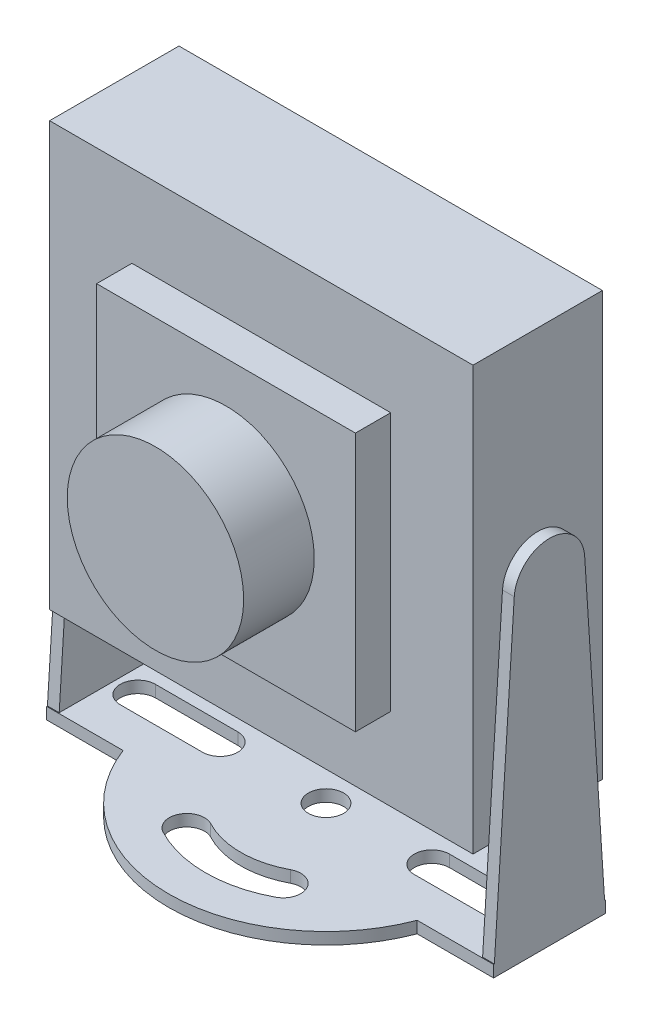
from build123d import *

# Parameters (mm, degrees)
SKETCH_1_W          = 36
SKETCH_1_H          = 36
EXTRUDE_1_DEPTH     = 11
SKETCH_2_W          = 22
SKETCH_2_H          = 22
EXTRUDE_2_DEPTH     = 3
SKETCH_3_R          = 7.5
EXTRUDE_3_DEPTH     = 6
EXTRUDE_4_DEPTH     = 1
EXTRUDE_5_DEPTH     = 1
SKETCH_6_R          = 1.5
CUT_EXTRUDE_1_DEPTH = 1


with BuildPart() as part:
    # 草图1 → 凸台-拉伸1 (new body)
    with BuildSketch(Plane.XY):
        Rectangle(SKETCH_1_W, SKETCH_1_H)
    extrude(amount=EXTRUDE_1_DEPTH)

    # 草图2 → 凸台-拉伸2 (add)
    with BuildSketch(Plane.XY.offset(11)):
        Rectangle(SKETCH_2_W, SKETCH_2_H)
    extrude(amount=EXTRUDE_2_DEPTH)

    # 草图3 → 凸台-拉伸3 (add)
    with BuildSketch(Plane.XY.offset(14)):
        Circle(SKETCH_3_R)
    extrude(amount=EXTRUDE_3_DEPTH)

    # 草图4 → 凸台-拉伸4 (add)
    with BuildSketch(Plane(origin=(18, 0, 0), x_dir=(0, 0, -1), z_dir=(1, 0, 0))):
        with BuildLine():
            Line((-8.493762994, 0.193347193), (-10.25, -27))
            Line((-10.25, -27), (-0.75, -27))
            Line((-0.75, -27), (-2.506237006, 0.193347193))
            ThreePointArc((-2.506237006, 0.193347193), (-5.5, 3), (-8.493762994, 0.193347193))
        make_face()
    extrude_4 = extrude(amount=EXTRUDE_4_DEPTH)

    # 镜向1: 凸台-拉伸4 across plane
    add(extrude_4.mirror(Plane(origin=(0, 0, 0), x_dir=(0, 0, 1), z_dir=(1, 0, 0))))

    # 草图5 → 凸台-拉伸5 (add)
    with BuildSketch(Plane.XZ.offset(27)):
        with BuildLine():
            Line((-19, 10.25), (-12.5, 10.25))
            ThreePointArc((-12.5, 10.25), (0, 18.87207912), (12.5, 10.25))
            Line((12.5, 10.25), (19, 10.25))
            Line((19, 10.25), (19, 0.75))
            Line((19, 0.75), (12.5, 0.75))
            ThreePointArc((12.5, 0.75), (0, -7.87207912), (-12.5, 0.75))
            Line((-12.5, 0.75), (-19, 0.75))
            Line((-19, 0.75), (-19, 10.25))
        make_face()
    extrude(amount=-EXTRUDE_5_DEPTH)

    # 草图6 → 切除-拉伸1 (cut)
    with BuildSketch(Plane.XZ.offset(27)):
        with Locations((0, 5.5)):
            Circle(SKETCH_6_R)
        with BuildLine():
            Line((-16, 7), (-9, 7))
            ThreePointArc((-9, 7), (-7.5, 5.5), (-9, 4))
            Line((-9, 4), (-16, 4))
            ThreePointArc((-16, 4), (-17.5, 5.5), (-16, 7))
        make_face()
        with BuildLine():
            Line((9, 7), (16, 7))
            ThreePointArc((16, 7), (17.5, 5.5), (16, 4))
            Line((16, 4), (9, 4))
            ThreePointArc((9, 4), (7.5, 5.5), (9, 7))
        make_face()
        with BuildLine():
            ThreePointArc((-4.79529689, 14.55926341), (0, 15.750128087), (4.79529689, 14.55926341))
            ThreePointArc((4.79529689, 14.55926341), (5.419284193, 12.531792117), (3.3918129, 11.907804814))
            ThreePointArc((3.3918129, 11.907804814), (0, 12.750128087), (-3.3918129, 11.907804814))
            ThreePointArc((-3.3918129, 11.907804814), (-5.419284193, 12.531792117), (-4.79529689, 14.55926341))
        make_face()
        with BuildLine():
            ThreePointArc((-4.79529689, -3.55926341), (-5.419284193, -1.531792117), (-3.3918129, -0.907804814))
            ThreePointArc((-3.3918129, -0.907804814), (0, -1.750128087), (3.3918129, -0.907804814))
            ThreePointArc((3.3918129, -0.907804814), (5.419284193, -1.531792117), (4.79529689, -3.55926341))
            ThreePointArc((4.79529689, -3.55926341), (0, -4.750128087), (-4.79529689, -3.55926341))
        make_face()
    extrude(amount=-CUT_EXTRUDE_1_DEPTH, mode=Mode.SUBTRACT)


solid = part.part
